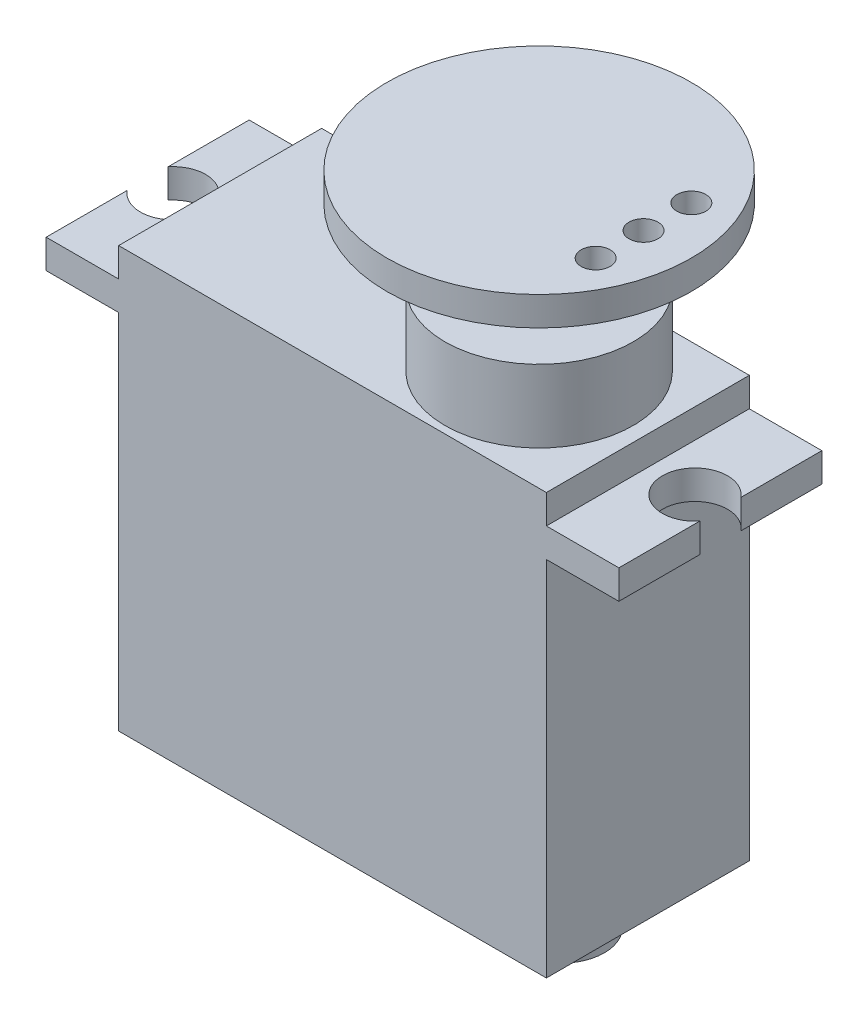
from build123d import *

# Parameters (mm, degrees)
SKETCH_1_W          = 29.5
SKETCH_1_H          = 29
EXTRUDE_1_DEPTH     = 7
SKETCH_2_W          = 5
SKETCH_2_H          = 14
EXTRUDE_2_DEPTH     = 2
SKETCH_3_R          = 2.25
CUT_EXTRUDE_1_DEPTH = 35.176929353
SKETCH_4_R          = 6.5
SKETCH_4_R_2        = 2.5
EXTRUDE_3_DEPTH     = 5
SKETCH_5_R          = 3
EXTRUDE_4_DEPTH     = 3.5
EXTRUDE_START       = 10
SKETCH_4_3_R        = 10.5
EXTRUDE_5_DEPTH     = 2
SKETCH_4_4_R        = 2.5
EXTRUDE_6_DEPTH     = 10
CUT_EXTRUDE_2_REACH = 51.805
SKETCH_6_R          = 1


with BuildPart() as part:
    # 스케치1 → 보스-돌출1 (new, symmetric)
    with BuildSketch(Plane.XY):
        with Locations((0, -14.5)):
            Rectangle(SKETCH_1_W, SKETCH_1_H)
    extrude(amount=EXTRUDE_1_DEPTH, both=True)

    # 스케치2 → 보스-돌출2 (add)
    with BuildSketch(Plane(origin=(0, -2, 0), x_dir=(1, 0, 0), z_dir=(0, 1, 0))):
        with Locations((17.25, 0)):
            Rectangle(SKETCH_2_W, SKETCH_2_H)
    extrude_2 = extrude(amount=-EXTRUDE_2_DEPTH)

    # 스케치3 → 컷-돌출1 (cut, through all)
    with BuildSketch(Plane(origin=(0, -2, 0), x_dir=(1, 0, 0), z_dir=(0, 1, 0))):
        with Locations((18, 0)):
            Circle(SKETCH_3_R)
    cut_extrude_1 = extrude(amount=-CUT_EXTRUDE_1_DEPTH, mode=Mode.SUBTRACT)

    # 스케치4 → 보스-돌출3 (add)
    with BuildSketch(Plane(origin=(0, 0, 0), x_dir=(1, 0, 0), z_dir=(0, 1, 0))):
        with Locations(Location((7.25, 0, 0), (0, 0, 270))):
            Circle(SKETCH_4_R)
        with Locations(Location((7.25, 0, 0), (0, 0, 270))):
            Circle(SKETCH_4_R_2, mode=Mode.SUBTRACT)
    extrude(amount=EXTRUDE_3_DEPTH)

    # 대칭 복사1: 보스-돌출2, 컷-돌출1 across plane
    add(extrude_2.mirror(Plane(origin=(0, 0, 0), x_dir=(0, 0, 1), z_dir=(1, 0, 0))))
    add(cut_extrude_1.mirror(Plane(origin=(0, 0, 0), x_dir=(0, 0, 1), z_dir=(1, 0, 0))), mode=Mode.SUBTRACT)

    # 스케치5 → 보스-돌출4 (add)
    with BuildSketch(Plane.XZ.offset(29)):
        with Locations(Location((8.75, 0, 0), (0, 0, 180))):
            Circle(SKETCH_5_R)
    extrude(amount=EXTRUDE_4_DEPTH)



with BuildPart() as body_2:
    # 스케치4<3> → 보스-돌출5 (new body)
    with BuildSketch(Plane(origin=(0, 0, 0), x_dir=(1, 0, 0), z_dir=(0, 1, 0)).offset(EXTRUDE_START)):
        with Locations(Location((7.25, 0, 0), (0, 0, 270))):
            Circle(SKETCH_4_3_R)
    extrude(amount=EXTRUDE_5_DEPTH)


with BuildPart() as part_1:
    add(part.part)

    add(body_2.part)  # 보스-돌출6 merges body 2
    # 스케치4<4> → 보스-돌출6 (add)
    with BuildSketch(Plane(origin=(0, 0, 0), x_dir=(1, 0, 0), z_dir=(0, 1, 0))):
        with Locations(Location((7.25, 0, 0), (0, 0, 270))):
            Circle(SKETCH_4_4_R)
    extrude(amount=EXTRUDE_6_DEPTH)

    # 스케치6 → 컷-돌출2 (cut, up to next)
    with BuildSketch(Plane(origin=(0, 12, 0), x_dir=(1, 0, 0), z_dir=(0, 1, 0)), mode=Mode.PRIVATE) as cut_extrude_2_sk1:
        with Locations(Location((14.45, 3.3, 0), (0, 0, 270))):
            Circle(SKETCH_6_R)
    cut_extrude_2_tool1 = extrude(cut_extrude_2_sk1.sketch, amount=-CUT_EXTRUDE_2_REACH, mode=Mode.PRIVATE) & part_1.part
    # 스케치6 → 컷-돌출2 (cut, up to next)
    with BuildSketch(Plane(origin=(0, 12, 0), x_dir=(1, 0, 0), z_dir=(0, 1, 0)), mode=Mode.PRIVATE) as cut_extrude_2_sk2:
        with Locations(Location((14.45, 0, 0), (0, 0, 270))):
            Circle(SKETCH_6_R)
    cut_extrude_2_tool2 = extrude(cut_extrude_2_sk2.sketch, amount=-CUT_EXTRUDE_2_REACH, mode=Mode.PRIVATE) & part_1.part
    # 스케치6 → 컷-돌출2 (cut, up to next)
    with BuildSketch(Plane(origin=(0, 12, 0), x_dir=(1, 0, 0), z_dir=(0, 1, 0)), mode=Mode.PRIVATE) as cut_extrude_2_sk3:
        with Locations(Location((14.45, -3.3, 0), (0, 0, 270))):
            Circle(SKETCH_6_R)
    cut_extrude_2_tool3 = extrude(cut_extrude_2_sk3.sketch, amount=-CUT_EXTRUDE_2_REACH, mode=Mode.PRIVATE) & part_1.part
    add(cut_extrude_2_tool1.solids().sort_by_distance((14.45, 12, -3.3))[0], mode=Mode.SUBTRACT)
    add(cut_extrude_2_tool2.solids().sort_by_distance((14.45, 12, 0))[0], mode=Mode.SUBTRACT)
    add(cut_extrude_2_tool3.solids().sort_by_distance((14.45, 12, 3.3))[0], mode=Mode.SUBTRACT)


solid = part_1.part
